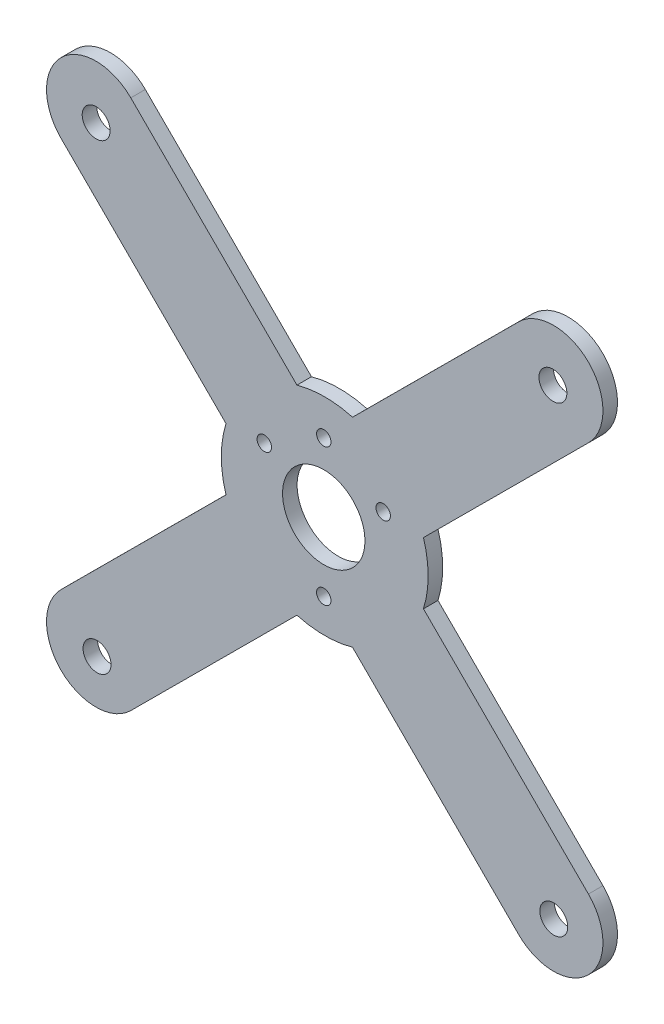
from build123d import *

# Parameters (mm, degrees)
MODEL_R             = 1.575000001
MODEL_R_2           = 3.05
MODEL_R_3           = 9.000000001
BOSS_EXTRUDE1_DEPTH = 3.175


with BuildPart() as part:
    # Model → Boss-Extrude1 (new body)
    with BuildSketch(Plane.XY):
        with BuildLine():
            Line((-57.393758137, 42.970698671), (-21.353966815, 7.026278384))
            ThreePointArc((-21.353966815, 7.026278384), (-22.382377018, 0.28718893), (-21.353966815, -6.451900523))
            Line((-21.353966815, -6.451900523), (-57.393758137, -42.39632081))
            ThreePointArc((-57.393758137, -42.39632081), (-57.413974609, -57.655322639), (-42.15497278, -57.675539111))
            Line((-42.15497278, -57.675539111), (-5.859634798, -21.47624841))
            ThreePointArc((-5.859634798, -21.47624841), (0.212184024, -22.307372111), (6.284002846, -21.47624841))
            Line((6.284002846, -21.47624841), (42.579340828, -57.675539111))
            ThreePointArc((42.579340828, -57.675539111), (57.838342657, -57.655322639), (57.818126185, -42.39632081))
            Line((57.818126185, -42.39632081), (21.778334863, -6.451900523))
            ThreePointArc((21.778334863, -6.451900523), (22.806745065, 0.28718893), (21.778334863, 7.026278384))
            Line((21.778334863, 7.026278384), (57.818126185, 42.970698671))
            ThreePointArc((57.818126185, 42.970698671), (57.838342657, 58.229700499), (42.579340828, 58.249916972))
            Line((42.579340828, 58.249916972), (6.284002846, 22.05062627))
            ThreePointArc((6.284002846, 22.05062627), (0.212184024, 22.881749972), (-5.859634798, 22.05062627))
            Line((-5.859634798, 22.05062627), (-42.15497278, 58.249916972))
            ThreePointArc((-42.15497278, 58.249916972), (-57.413974609, 58.229700499), (-57.393758137, 42.970698671))
        make_face()
        with Locations((0, 15)):
            Circle(MODEL_R, mode=Mode.SUBTRACT)
        with Locations((-49.72265974, 49.752211816)):
            Circle(MODEL_R_2, mode=Mode.SUBTRACT)
        with Locations(Location((50.062895685, 49.995974034, 0), (0, 0, 180))):
            Circle(MODEL_R_2, mode=Mode.SUBTRACT)
        with Locations((50.250439225, -50.894025966)):
            Circle(MODEL_R_2, mode=Mode.SUBTRACT)
        with Locations(Location((-49.534886134, -51.141545777, 0), (0, 0, 180))):
            Circle(MODEL_R_2, mode=Mode.SUBTRACT)
        with Locations((-12.99, 7.5)):
            Circle(MODEL_R, mode=Mode.SUBTRACT)
        with Locations(Location((12.99, 7.5, 0), (0, 0, 180))):
            Circle(MODEL_R, mode=Mode.SUBTRACT)
        Circle(MODEL_R_3, mode=Mode.SUBTRACT)
        with Locations(Location((0, -15, 0), (0, 0, 180))):
            Circle(MODEL_R, mode=Mode.SUBTRACT)
    extrude(amount=BOSS_EXTRUDE1_DEPTH)


solid = part.part
